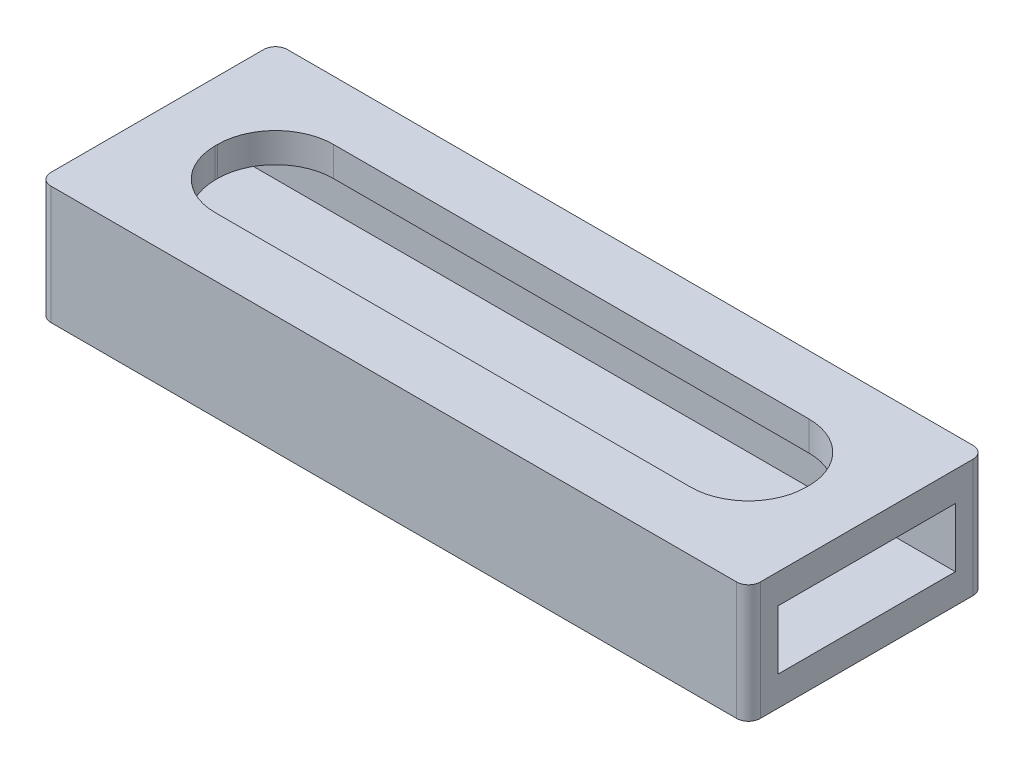
from build123d import *

# Parameters (mm, degrees)
SKETCH1_W           = 76.2
SKETCH1_H           = 25.4
BOSS_EXTRUDE1_DEPTH = 12.7
SKETCH2_W           = 19.05
SKETCH2_H           = 6.35
CUT_EXTRUDE1_DEPTH  = 82.319677815
CUT_EXTRUDE2_DEPTH  = 3.175
FILLET1_R           = 1.27


with BuildPart() as part:
    # Sketch1 → Boss-Extrude1 (new body)
    with BuildSketch(Plane(origin=(0, 0, 0), x_dir=(1, 0, 0), z_dir=(0, 1, 0))):
        with Locations((38.1, 12.7)):
            Rectangle(SKETCH1_W, SKETCH1_H)
    extrude(amount=BOSS_EXTRUDE1_DEPTH)

    # Sketch2 → Cut-Extrude1 (cut, through all)
    with BuildSketch(Plane(origin=(76.2, 0, 0), x_dir=(0, 0, -1), z_dir=(1, 0, 0))):
        with Locations((12.7, 6.35)):
            Rectangle(SKETCH2_W, SKETCH2_H)
    extrude(amount=-CUT_EXTRUDE1_DEPTH, mode=Mode.SUBTRACT)

    # Sketch3 → Cut-Extrude2 (cut)
    with BuildSketch(Plane(origin=(0, 12.7, 0), x_dir=(1, 0, 0), z_dir=(0, 1, 0))):
        with BuildLine():
            Line((12.573, 6.35), (63.627, 6.35))
            ThreePointArc((63.627, 6.35), (68.027325499, 8.172674501), (69.85, 12.573))
            Line((69.85, 12.573), (69.85, 12.827))
            ThreePointArc((69.85, 12.827), (68.027325499, 17.227325499), (63.627, 19.05))
            Line((63.627, 19.05), (12.573, 19.05))
            ThreePointArc((12.573, 19.05), (8.172674501, 17.227325499), (6.35, 12.827))
            Line((6.35, 12.827), (6.35, 12.573))
            ThreePointArc((6.35, 12.573), (8.172674501, 8.172674501), (12.573, 6.35))
        make_face()
    extrude(amount=-CUT_EXTRUDE2_DEPTH, mode=Mode.SUBTRACT)

    # Fillet1
    fillet1_edges = [part.edges().sort_by_distance(p)[0] for p in [
        (0, 6.35, -25.4),
        (76.2, 6.35, -25.4),
        (76.2, 6.35, 0),
        (0, 6.35, 0),
    ]]
    fillet(fillet1_edges, radius=FILLET1_R)


solid = part.part
